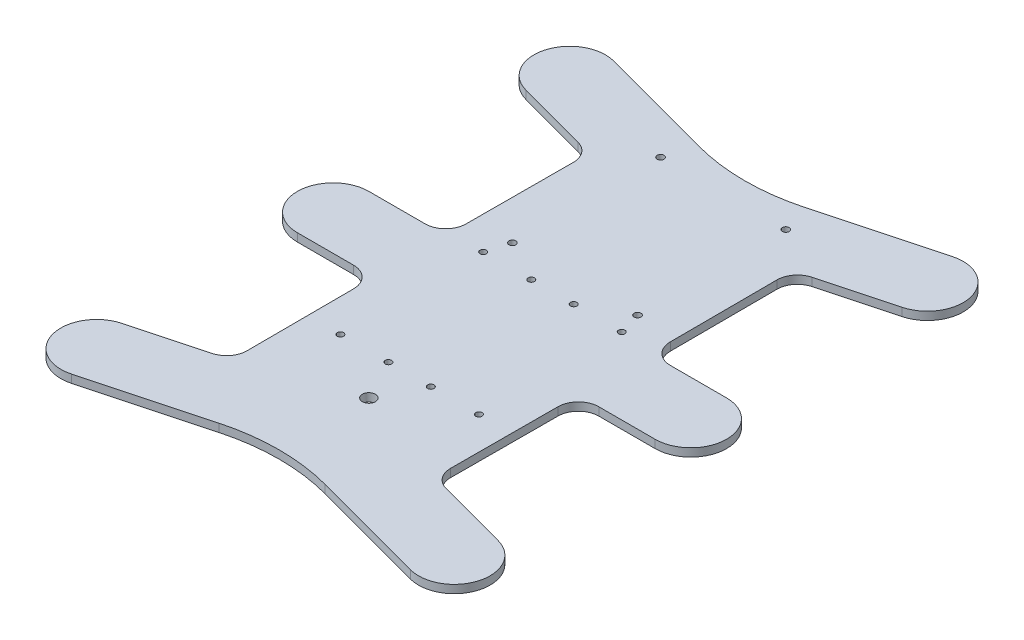
from build123d import *

# Parameters (mm, degrees)
BOSS_EXTRUDE1_DEPTH = 3.175
FILLET1_R           = 80
FILLET2_R           = 8
SKETCH2_R           = 1.35
CUT_EXTRUDE1_DEPTH  = 136.741386774
SKETCH3_R           = 1.25
CUT_EXTRUDE2_DEPTH  = 136.741386774
SKETCH5_R           = 2.55
CUT_EXTRUDE3_DEPTH  = 136.741386774


with BuildPart() as part:
    # Sketch1 → Boss-Extrude1 (new body)
    with BuildSketch(Plane(origin=(0, 0, 0), x_dir=(1, 0, 0), z_dir=(0, 1, 0))):
        with BuildLine():
            Line((-70, 14), (-40, 14))
            Line((-40, 14), (-39.816062711, 70))
            Line((-39.816062711, 70), (-73.623466631, 79.058666579))
            ThreePointArc((-73.623466631, 79.058666579), (-83.522961568, 96.205094778), (-66.376533369, 106.104589715))
            Line((-66.376533369, 106.104589715), (0, 88.319051202))
            Line((0, 88.319051202), (66.376533369, 106.104589715))
            ThreePointArc((66.376533369, 106.104589715), (83.522961568, 96.205094778), (73.623466631, 79.058666579))
            Line((73.623466631, 79.058666579), (39.816062711, 70))
            Line((39.816062711, 70), (40, 14))
            Line((40, 14), (70, 14))
            ThreePointArc((70, 14), (84, 0), (70, -14))
            Line((70, -14), (40, -14))
            Line((40, -14), (39.816062711, -70))
            Line((39.816062711, -70), (73.623466631, -79.058666579))
            ThreePointArc((73.623466631, -79.058666579), (83.522961568, -96.205094778), (66.376533369, -106.104589715))
            Line((66.376533369, -106.104589715), (0, -88.319051202))
            Line((0, -88.319051202), (-66.376533369, -106.104589715))
            ThreePointArc((-66.376533369, -106.104589715), (-83.522961568, -96.205094778), (-73.623466631, -79.058666579))
            Line((-73.623466631, -79.058666579), (-39.816062711, -70))
            Line((-39.816062711, -70), (-40, -14))
            Line((-40, -14), (-70, -14))
            ThreePointArc((-70, -14), (-84, 0), (-70, 14))
        make_face()
    extrude(amount=BOSS_EXTRUDE1_DEPTH)

    # Fillet1
    fillet1_edges = [part.edges().sort_by_distance(p)[0] for p in [
        (0, 1.5875, -88.319051202),
        (0, 1.5875, 88.319051202),
    ]]
    fillet(fillet1_edges, radius=FILLET1_R)

    # Fillet2
    fillet2_edges = [part.edges().sort_by_distance(p)[0] for p in [
        (-40, 1.5875, -14),
        (-39.816062711, 1.5875, -70),
        (39.816062711, 1.5875, -70),
        (40, 1.5875, -14),
        (40, 1.5875, 14),
        (39.816062711, 1.5875, 70),
        (-39.816062711, 1.5875, 70),
        (-40, 1.5875, 14),
    ]]
    fillet(fillet2_edges, radius=FILLET2_R)

    # Sketch2 → Cut-Extrude1 (cut, through all)
    with BuildSketch(Plane(origin=(0, 3.175, 0), x_dir=(1, 0, 0), z_dir=(0, 1, 0))):
        with Locations(Location((-24.5, 24.641145635, 0), (0, 0, 270))):
            Circle(SKETCH2_R)
        with Locations(Location((24.5, 24.641145635, 0), (0, 0, 270))):
            Circle(SKETCH2_R)
        with Locations(Location((24.5, 82.641145635, 0), (0, 0, 270))):
            Circle(SKETCH2_R)
        with Locations(Location((-24.5, 82.641145635, 0), (0, 0, 270))):
            Circle(SKETCH2_R)
    extrude(amount=-CUT_EXTRUDE1_DEPTH, mode=Mode.SUBTRACT)

    # Sketch3 → Cut-Extrude2 (cut, through all)
    with BuildSketch(Plane(origin=(0, 3.175, 0), x_dir=(1, 0, 0), z_dir=(0, 1, 0))):
        with Locations(Location((-8.3, -40.058854365, 0), (0, 0, 270))):
            Circle(SKETCH3_R)
        with Locations(Location((-27.1, -40.058854365, 0), (0, 0, 270))):
            Circle(SKETCH3_R)
        with Locations(Location((-27.1, 15.841145635, 0), (0, 0, 270))):
            Circle(SKETCH3_R)
        with Locations(Location((-8.3, 15.841145635, 0), (0, 0, 270))):
            Circle(SKETCH3_R)
        with Locations(Location((8.3, 15.841145635, 0), (0, 0, 270))):
            Circle(SKETCH3_R)
        with Locations(Location((27.1, 15.841145635, 0), (0, 0, 270))):
            Circle(SKETCH3_R)
        with Locations(Location((8.3, -40.058854365, 0), (0, 0, 270))):
            Circle(SKETCH3_R)
        with Locations(Location((27.1, -40.058854365, 0), (0, 0, 270))):
            Circle(SKETCH3_R)
    extrude(amount=-CUT_EXTRUDE2_DEPTH, mode=Mode.SUBTRACT)

    # Sketch5 → Cut-Extrude3 (cut, through all)
    with BuildSketch(Plane(origin=(0, 3.175, 0), x_dir=(1, 0, 0), z_dir=(0, 1, 0))):
        with Locations(Location((0, -56.018854365, 0), (0, 0, 270))):
            Circle(SKETCH5_R)
    extrude(amount=-CUT_EXTRUDE3_DEPTH, mode=Mode.SUBTRACT)


solid = part.part
